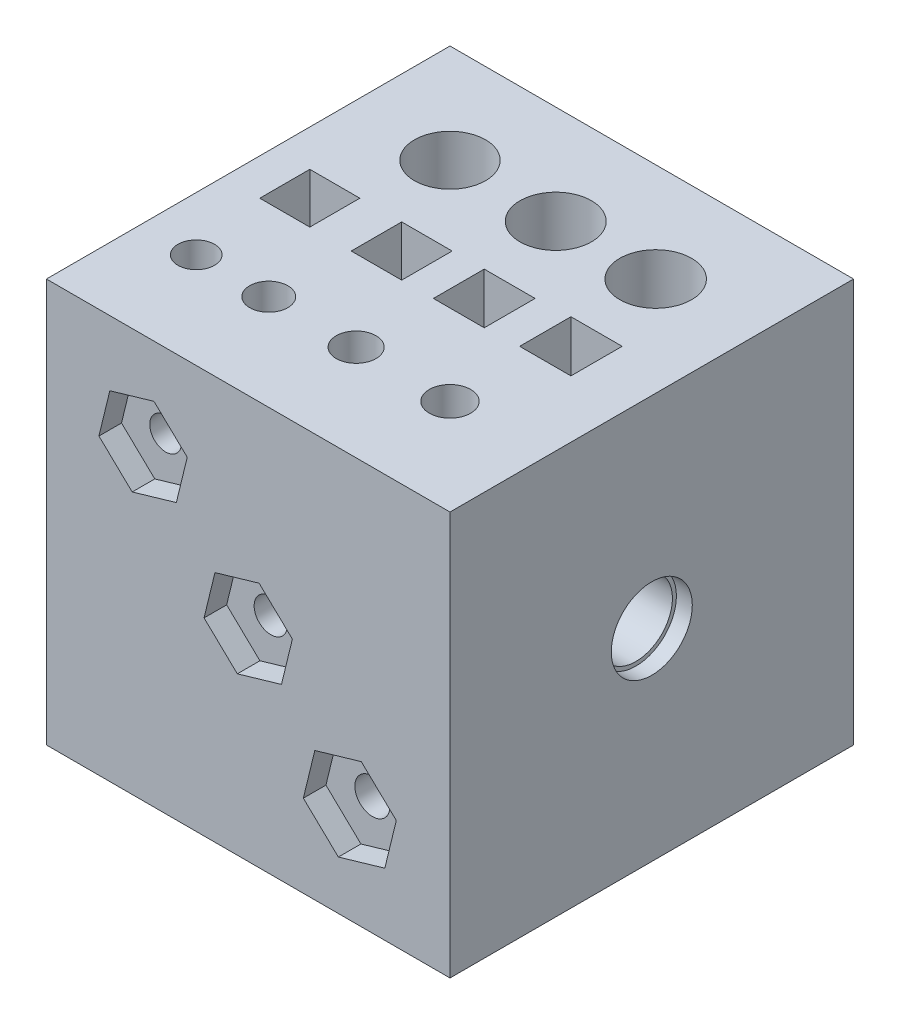
from build123d import *

# Parameters (mm, degrees)
SKETCH1_W           = 25.4
SKETCH1_H           = 25.4
SKETCH1_R           = 1.15
SKETCH1_R_2         = 1.2
SKETCH1_W_2         = 3.1496
SKETCH1_H_2         = 3.1496
SKETCH1_R_3         = 1.25
SKETCH1_R_4         = 1.3
SKETCH1_W_3         = 3.175
SKETCH1_H_3         = 3.175
SKETCH1_R_5         = 2.2352
SKETCH1_W_4         = 3.2004
SKETCH1_H_4         = 3.2004
SKETCH1_W_5         = 3.2258
SKETCH1_H_5         = 3.2258
SKETCH1_R_6         = 2.2479
SKETCH1_R_7         = 2.2606
BOSS_EXTRUDE1_DEPTH = 25.4
SKETCH2_R           = 1.05
SKETCH2_R_2         = 1.0033
SKETCH2_R_3         = 1.1049
CUT_EXTRUDE2_DEPTH  = 39.1
SKETCH2_3_R         = 1.05
SKETCH2_3_R_2       = 1.0033
SKETCH2_3_R_3       = 1.1049
CUT_EXTRUDE3_DEPTH  = 1.4224
CUT_EXTRUDE6_DEPTH  = 1.4224
SKETCH4_R           = 2.3
CUT_EXTRUDE7_DEPTH  = 8.8
SKETCH4_3_R         = 2.55
SKETCH4_3_R_2       = 2.3
CUT_EXTRUDE8_DEPTH  = 1


with BuildPart() as part:
    # Sketch1 → Boss-Extrude1 (new body)
    with BuildSketch(Plane(origin=(0, 0, 0), x_dir=(1, 0, 0), z_dir=(0, 1, 0))):
        Rectangle(SKETCH1_W, SKETCH1_H)
        with Locations((-9.305114473, -6.668264901)):
            Circle(SKETCH1_R, mode=Mode.SUBTRACT)
        with Locations((-4.739326615, -6.668264901)):
            Circle(SKETCH1_R_2, mode=Mode.SUBTRACT)
        with Locations((-8.815513798, -0.007675087)):
            Rectangle(SKETCH1_W_2, SKETCH1_H_2, mode=Mode.SUBTRACT)
        with Locations((0.760372397, -6.668264901)):
            Circle(SKETCH1_R_3, mode=Mode.SUBTRACT)
        with Locations((6.668264901, -6.668264901)):
            Circle(SKETCH1_R_4, mode=Mode.SUBTRACT)
        with Locations((-3.045097336, 0.005024913)):
            Rectangle(SKETCH1_W_3, SKETCH1_H_3, mode=Mode.SUBTRACT)
        with Locations((-6.472968259, 6.472968259)):
            Circle(SKETCH1_R_5, mode=Mode.SUBTRACT)
        with Locations((2.137919408, 0.017724913)):
            Rectangle(SKETCH1_W_4, SKETCH1_H_4, mode=Mode.SUBTRACT)
        with Locations((7.474377115, 0.135948088)):
            Rectangle(SKETCH1_W_5, SKETCH1_H_5, mode=Mode.SUBTRACT)
        with Locations((0.181353921, 6.472968259)):
            Circle(SKETCH1_R_6, mode=Mode.SUBTRACT)
        with Locations((6.472968259, 6.472968259)):
            Circle(SKETCH1_R_7, mode=Mode.SUBTRACT)
    extrude(amount=BOSS_EXTRUDE1_DEPTH)

    # Sketch2 → Cut-Extrude2 (cut, through all)
    with BuildSketch(Plane.XY.offset(12.7)):
        with Locations((0, 12.7)):
            Circle(SKETCH2_R)
        with Locations((-6.617185282, 19.303283632)):
            Circle(SKETCH2_R_2)
        with Locations((6.394758886, 6.041109769)):
            Circle(SKETCH2_R_3)
    extrude(amount=-CUT_EXTRUDE2_DEPTH, mode=Mode.SUBTRACT)

    # Sketch2<3> → Cut-Extrude3 (cut)
    # profile 1 of 3: a face of its own
    with BuildSketch(Plane.XY.offset(12.7)):
        Polygon((0.68588349, 15.513194483), (-2.093356143, 14.700589768), (-2.779239633, 11.887395285), (-0.68588349, 9.886805517), (2.093356143, 10.699410232), (2.779239633, 13.512604715), align=None)
        with Locations((0, 12.7)):
            Circle(SKETCH2_3_R, mode=Mode.SUBTRACT)
    # profile 2 of 3: a face of its own
    with BuildSketch(Plane.XY.offset(12.7)):
        Polygon((-5.931301792, 22.116478115), (-8.710541425, 21.3038734), (-9.396424915, 18.490678917), (-7.303068771, 16.490089149), (-4.523829139, 17.302693864), (-3.837945649, 20.115888347), align=None)
        with Locations((-6.617185282, 19.303283632)):
            Circle(SKETCH2_3_R_2, mode=Mode.SUBTRACT)
    # profile 3 of 3: a face of its own
    with BuildSketch(Plane.XY.offset(12.7)):
        Polygon((7.116741506, 9.002367119), (4.191226103, 8.146993735), (3.469243483, 5.185736385), (5.672776265, 3.079852419), (8.598291668, 3.935225803), (9.320274289, 6.896483154), align=None)
        with Locations((6.394758886, 6.041109769)):
            Circle(SKETCH2_3_R_3, mode=Mode.SUBTRACT)
    extrude(amount=-CUT_EXTRUDE3_DEPTH, mode=Mode.SUBTRACT)

    # Sketch1<4> → Cut-Extrude6 (cut)
    with BuildSketch(Plane(origin=(0, 0, 0), x_dir=(1, 0, 0), z_dir=(0, 1, 0))):
        Polygon((-0.483756928, -11.238233107), (0, -12.146935387), (0.760372397, -11.238233107), align=None)
    extrude(amount=CUT_EXTRUDE6_DEPTH, mode=Mode.SUBTRACT)

    # Sketch4 → Cut-Extrude7 (cut)
    with BuildSketch(Plane(origin=(12.7, 0, 0), x_dir=(0, 0, -1), z_dir=(1, 0, 0))):
        with Locations((0, 12.7)):
            Circle(SKETCH4_R)
    extrude(amount=-CUT_EXTRUDE7_DEPTH, mode=Mode.SUBTRACT)

    # Sketch4<3> → Cut-Extrude8 (cut)
    with BuildSketch(Plane(origin=(12.7, 0, 0), x_dir=(0, 0, -1), z_dir=(1, 0, 0))):
        with Locations((0, 12.7)):
            Circle(SKETCH4_3_R)
        with Locations((0, 12.7)):
            Circle(SKETCH4_3_R_2, mode=Mode.SUBTRACT)
    extrude(amount=-CUT_EXTRUDE8_DEPTH, mode=Mode.SUBTRACT)


solid = part.part
